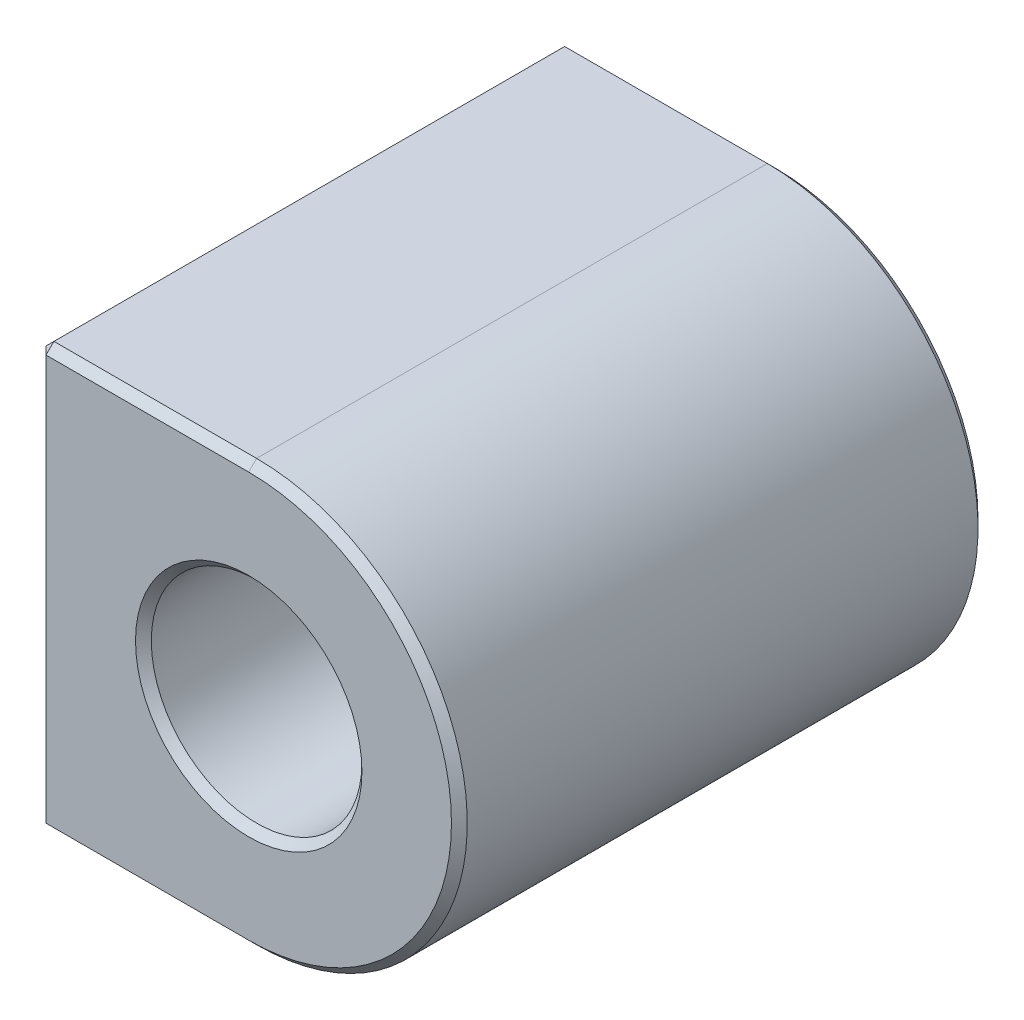
from build123d import *

# Parameters (mm, degrees)
SKETCH1_R           = 2
BOSS_EXTRUDE1_DEPTH = 5
CHAMFER1_SIZE       = 0.15


with BuildPart() as part:
    # Sketch1 → Boss-Extrude1 (new, symmetric)
    with BuildSketch(Plane.XY):
        with BuildLine():
            Line((0, 4), (-4, 4))
            Line((-4, 4), (-4, -4))
            Line((-4, -4), (0, -4))
            ThreePointArc((0, -4), (4, 0), (0, 4))
        make_face()
        Circle(SKETCH1_R, mode=Mode.SUBTRACT)
    extrude(amount=BOSS_EXTRUDE1_DEPTH, both=True)

    # Chamfer1
    chamfer1_edges = [part.edges().sort_by_distance(p)[0] for p in [
        (-2, 0, -5),
        (-2, 0, 5),
        (-4, 0, 5),
        (-2, -4, 5),
        (4, 0, 5),
        (-2, -4, -5),
        (-4, 0, -5),
        (-2, 4, -5),
        (4, 0, -5),
        (-4, -4, 0),
        (-4, 4, 0),
        (-2, 4, 5),
    ]]
    chamfer(chamfer1_edges, length=CHAMFER1_SIZE)


solid = part.part
